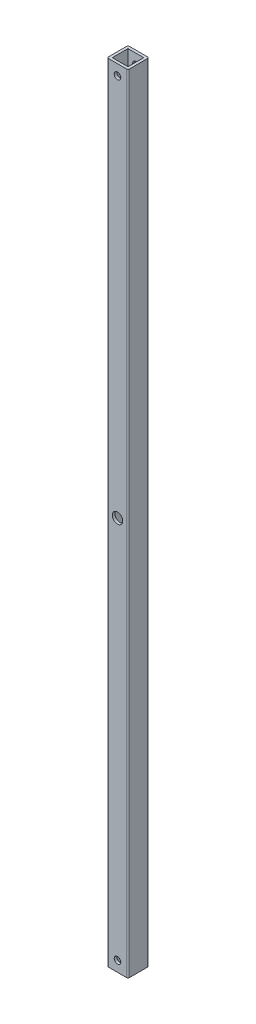
from build123d import *

# Parameters (mm, degrees)
SKETCH1_W           = 16
SKETCH1_H           = 16
SKETCH1_W_2         = 12
SKETCH1_H_2         = 12
BOSS_EXTRUDE1_DEPTH = 600
FILLET1_R           = 1
SKETCH2_R           = 2.5
SKETCH2_R_2         = 4
CUT_EXTRUDE1_DEPTH  = 16


with BuildPart() as part:
    # Sketch1 → Boss-Extrude1 (new body)
    with BuildSketch(Plane(origin=(0, 0, 0), x_dir=(1, 0, 0), z_dir=(0, 1, 0))):
        with Locations((1.861111111, -3.916666667)):
            Rectangle(SKETCH1_W, SKETCH1_H)
        with Locations((1.861111111, -3.916666667)):
            Rectangle(SKETCH1_W_2, SKETCH1_H_2, mode=Mode.SUBTRACT)
    extrude(amount=BOSS_EXTRUDE1_DEPTH)

    # Fillet1
    fillet1_edges = [part.edges().sort_by_distance(p)[0] for p in [
        (-6.138888889, 300, -4.083333333),
        (9.861111111, 300, -4.083333333),
        (9.861111111, 300, 11.916666667),
        (-6.138888889, 300, 11.916666667),
    ]]
    fillet(fillet1_edges, radius=FILLET1_R)

    # Sketch2 → Cut-Extrude1 (cut)
    with BuildSketch(Plane(origin=(0, 0, -4.083333333), x_dir=(-1, 0, 0), z_dir=(0, 0, -1))):
        with Locations((-1.861111111, 8)):
            Circle(SKETCH2_R)
        with Locations((-1.861111111, 592)):
            Circle(SKETCH2_R)
        with Locations((-1.861111111, 300)):
            Circle(SKETCH2_R_2)
    extrude(amount=-CUT_EXTRUDE1_DEPTH, mode=Mode.SUBTRACT)


solid = part.part
